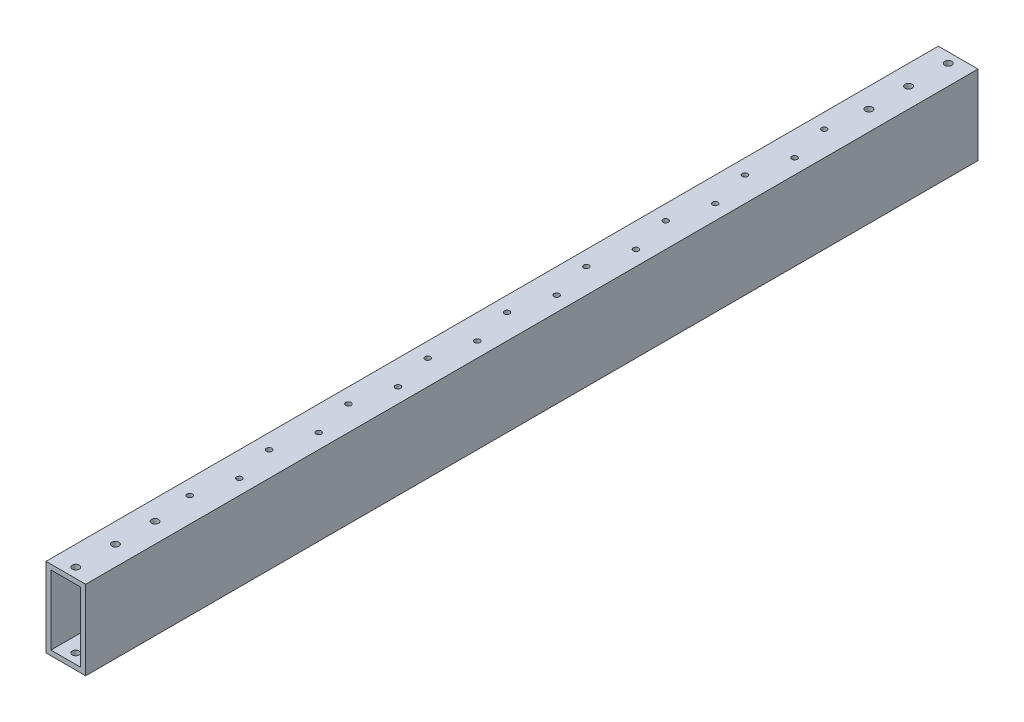
from build123d import *

# Parameters (mm, degrees)
SKETCH1_W                        = 25.4
SKETCH1_H                        = 50.8
SKETCH1_W_2                      = 19.05
SKETCH1_H_2                      = 44.45
EXTRUDE_THIN1_DEPTH              = 571.5
F_8_CLEARANCE_HOLE1_D            = 4.4958
F_1_8_0_135_DIAMETER_HOLE1_D     = 3.429
F_1_8_0_135_DIAMETER_HOLE1_DEPTH = 3.175


with BuildPart() as part:
    # Sketch1 → Extrude-Thin1 (new body)
    with BuildSketch(Plane.XY):
        Rectangle(SKETCH1_W, SKETCH1_H)
        Rectangle(SKETCH1_W_2, SKETCH1_H_2, mode=Mode.SUBTRACT)
    extrude(amount=EXTRUDE_THIN1_DEPTH)

    # #8 Clearance Hole1 (through all)
    with Locations(Plane(origin=(0, 25.4, 565.15), x_dir=(0, 0, 1), z_dir=(0, 1, 0))):
        with Locations((0, 0), (-558.8, 0), (-533.4, 0), (-508, 0), (-25.4, 0), (-50.8, 0)):
            Hole(F_8_CLEARANCE_HOLE1_D / 2)

    # 1/8 (0.135) Diameter Hole1
    with Locations(Plane(origin=(0, 25.4, 0), x_dir=(1, 0, 0), z_dir=(0, 1, 0))):
        with Locations((-3.175, -82.555663772), (3.175, -107.955663772), (-3.175, -133.355663772), (3.175, -158.755663772), (-3.175, -184.155663772), (3.175, -209.555663772), (-3.175, -234.955663772), (3.175, -260.355663772), (-3.175, -285.755663772), (3.175, -311.155663772), (-3.175, -336.555663772), (3.175, -361.955663772), (-3.175, -387.355663772), (3.175, -412.755663772), (-3.175, -438.155663772), (3.175, -463.555663772), (-3.175, -488.955663772)):
            Hole(F_1_8_0_135_DIAMETER_HOLE1_D / 2, depth=F_1_8_0_135_DIAMETER_HOLE1_DEPTH)


solid = part.part
